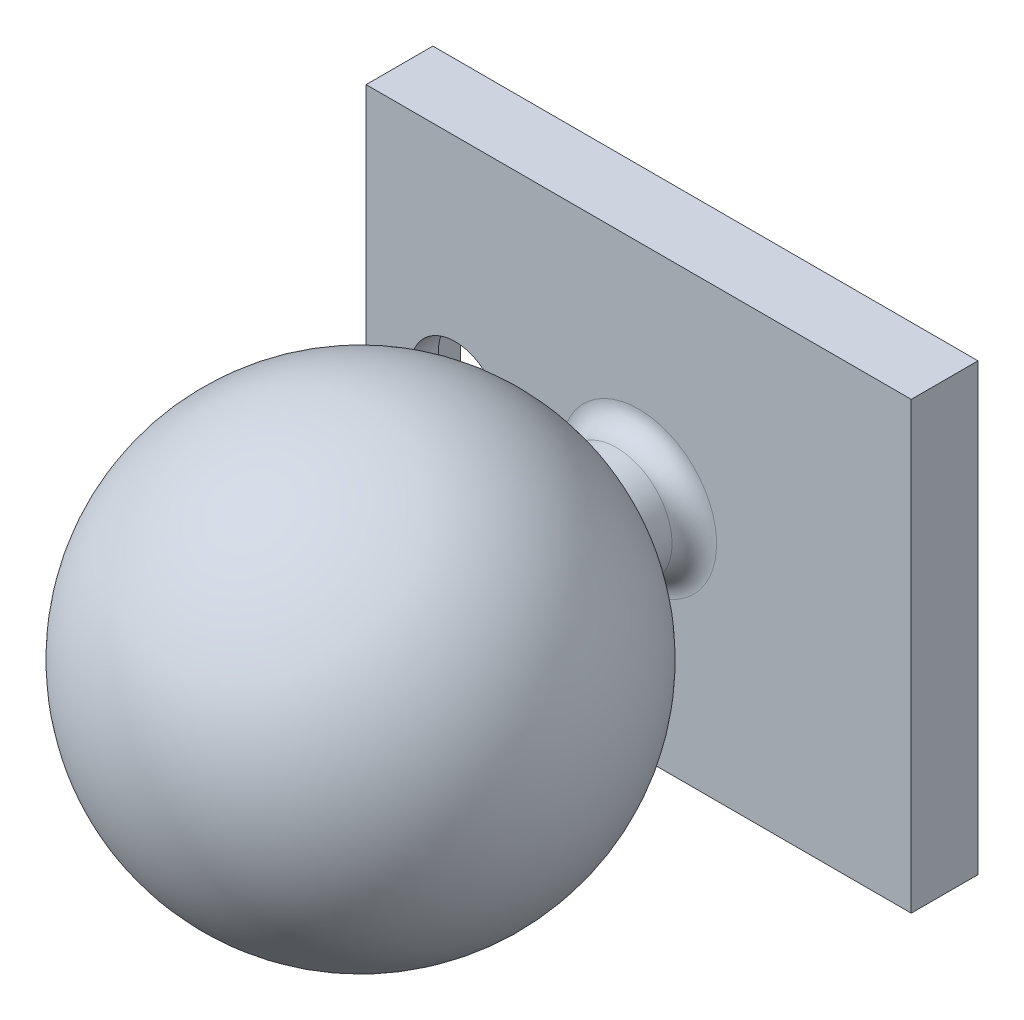
from build123d import *

# Parameters (mm, degrees)
SKETCH1_W           = 55.88
SKETCH1_H           = 44.45
BOSS_EXTRUDE1_DEPTH = 3.175
SKETCH2_W           = 62.23
SKETCH2_H           = 50.8
SKETCH2_W_2         = 55.88
SKETCH2_H_2         = 44.45
BOSS_EXTRUDE2_DEPTH = 7.62
FILLET1_R           = 2.54
SKETCH4_R           = 5.08
CUT_EXTRUDE1_DEPTH  = 15.875


with BuildPart() as part:
    # Sketch1 → Boss-Extrude1 (new body)
    with BuildSketch(Plane.XY):
        Rectangle(SKETCH1_W, SKETCH1_H)
    extrude(amount=BOSS_EXTRUDE1_DEPTH)

    # Sketch2 → Boss-Extrude2 (add)
    with BuildSketch(Plane.XY.offset(3.175)):
        Rectangle(SKETCH2_W, SKETCH2_H)
        Rectangle(SKETCH2_W_2, SKETCH2_H_2, mode=Mode.SUBTRACT)
    extrude(amount=-BOSS_EXTRUDE2_DEPTH)

    # Sketch3 → Revolve1 (revolve)
    with BuildSketch(Plane(origin=(0, 0, 0), x_dir=(1, 0, 0), z_dir=(0, 1, 0)), mode=Mode.PRIVATE) as revolve1_sk:
        with BuildLine():
            Line((0, -3.175), (6.35, -3.175))
            Line((6.35, -3.175), (6.35, -10.331555752))
            ThreePointArc((6.35, -10.331555752), (25.197554285, -38.125509029), (0, -60.325))
            Line((0, -60.325), (0, -3.175))
        make_face()
    revolve(revolve1_sk.sketch.rotate(Axis((0, 0, 0), (0, 0, 1)), 180), axis=Axis((0, 0, 0), (0, 0, 1)))

    # Fillet1
    fillet1_edges = [part.edges().sort_by_distance(p)[0] for p in [
        (6.35, 0, 3.175),
        (6.35, 0, 10.331555752),
    ]]
    fillet(fillet1_edges, radius=FILLET1_R)

    # Sketch4 → Cut-Extrude1 (cut)
    with BuildSketch(Plane.XY.offset(3.175)):
        with Locations((-20.955, 0)):
            Circle(SKETCH4_R)
    extrude(amount=-CUT_EXTRUDE1_DEPTH, mode=Mode.SUBTRACT)


solid = part.part
